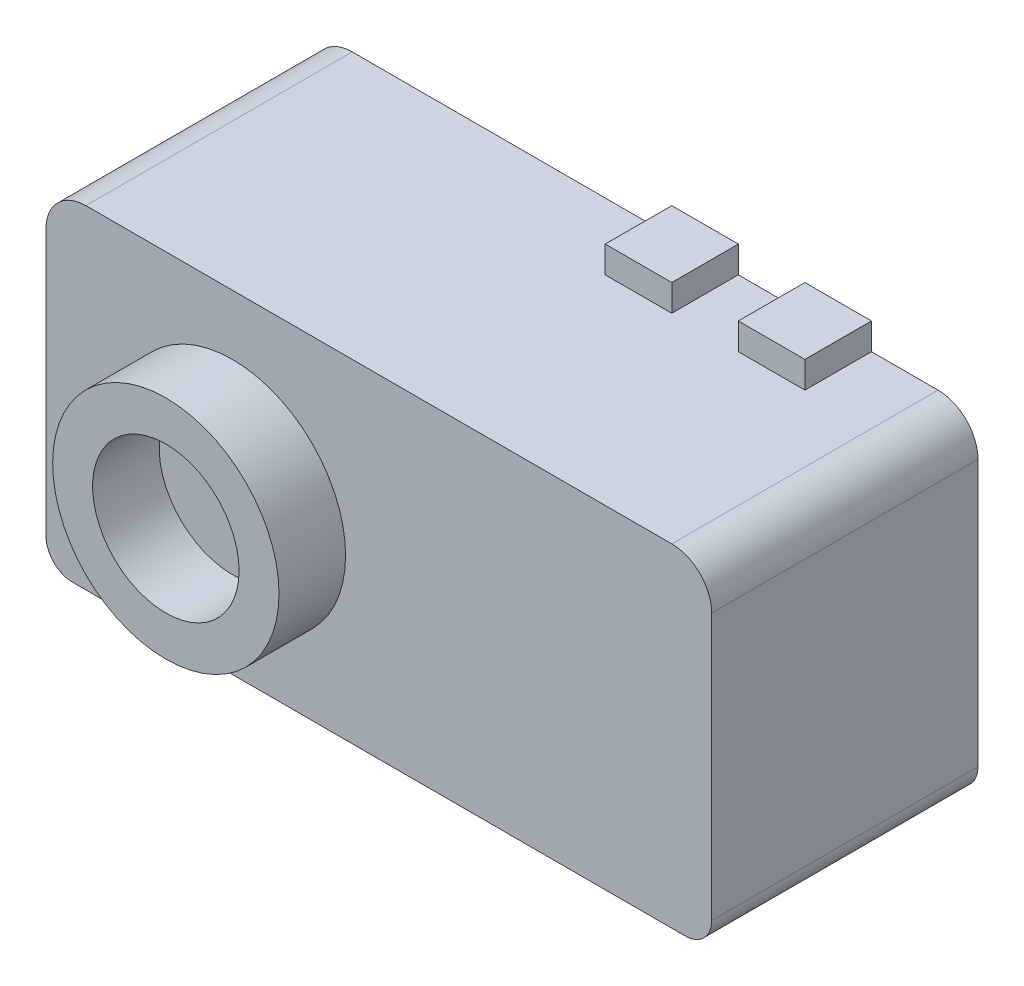
from build123d import *

# Parameters (mm, degrees)
BOSS_EXTRUDE1_DEPTH = 20
SKETCH2_W           = 5
SKETCH2_H           = 2
CUT_EXTRUDE1_DEPTH  = 15
SKETCH3_R           = 8.5
SKETCH3_R_2         = 5.5
BOSS_EXTRUDE2_DEPTH = 5
SKETCH4_W           = 11
SKETCH4_H           = 9
BOSS_EXTRUDE3_DEPTH = 10
SKETCH5_W           = 3
SKETCH5_H           = 3
CUT_EXTRUDE2_DEPTH  = 3
CUT_EXTRUDE3_START  = -8
SKETCH5_2_W         = 3
SKETCH5_2_H         = 3
CUT_EXTRUDE3_DEPTH  = 3


with BuildPart() as part:
    # Sketch1 → Boss-Extrude1 (new body)
    with BuildSketch(Plane.XY):
        with BuildLine():
            Line((-25, 10), (-25, -10))
            ThreePointArc((-25, -10), (-24.414213562, -11.414213562), (-23, -12))
            Line((-23, -12), (23, -12))
            ThreePointArc((23, -12), (24.414213562, -11.414213562), (25, -10))
            Line((25, -10), (25, 10))
            ThreePointArc((25, 10), (24.121320344, 12.121320344), (22, 13))
            Line((22, 13), (17, 13))
            Line((17, 13), (17, 15))
            Line((17, 15), (12, 15))
            Line((12, 15), (12, 13))
            Line((12, 13), (7, 13))
            Line((7, 13), (7, 15))
            Line((7, 15), (2, 15))
            Line((2, 15), (2, 13))
            Line((2, 13), (-22, 13))
            ThreePointArc((-22, 13), (-24.121320344, 12.121320344), (-25, 10))
        make_face()
    extrude(amount=BOSS_EXTRUDE1_DEPTH)

    # Sketch2 → Cut-Extrude1 (cut)
    with BuildSketch(Plane.XY.offset(20)):
        with Locations((4.5, 14)):
            Rectangle(SKETCH2_W, SKETCH2_H)
        with Locations((14.5, 14)):
            Rectangle(SKETCH2_W, SKETCH2_H)
    extrude(amount=-CUT_EXTRUDE1_DEPTH, mode=Mode.SUBTRACT)

    # Sketch3 → Boss-Extrude2 (add)
    with BuildSketch(Plane.XY.offset(20)):
        with Locations((-11, 0)):
            Circle(SKETCH3_R)
        with Locations((-11, 0)):
            Circle(SKETCH3_R_2, mode=Mode.SUBTRACT)
    extrude(amount=BOSS_EXTRUDE2_DEPTH)

    # Sketch4 → Boss-Extrude3 (add)
    with BuildSketch(Plane.XZ.offset(12)):
        with Locations((0, 4.5)):
            Rectangle(SKETCH4_W, SKETCH4_H)
    extrude(amount=BOSS_EXTRUDE3_DEPTH)

    # Sketch5 → Cut-Extrude2 (cut)
    with BuildSketch(Plane(origin=(5.5, 0, 0), x_dir=(0, 0, -1), z_dir=(1, 0, 0))):
        with Locations((-7.5, -20.5)):
            Rectangle(SKETCH5_W, SKETCH5_H)
        with Locations((-1.5, -20.5)):
            Rectangle(SKETCH5_W, SKETCH5_H)
        with Locations((-7.5, -15.5)):
            Rectangle(SKETCH5_W, SKETCH5_H)
        with Locations((-1.5, -15.5)):
            Rectangle(SKETCH5_W, SKETCH5_H)
    extrude(amount=-CUT_EXTRUDE2_DEPTH, mode=Mode.SUBTRACT)

    # Sketch5<2> → Cut-Extrude3 (cut)
    with BuildSketch(Plane(origin=(5.5, 0, 0), x_dir=(0, 0, -1), z_dir=(1, 0, 0)).offset(CUT_EXTRUDE3_START)):
        with Locations((-7.5, -20.5)):
            Rectangle(SKETCH5_2_W, SKETCH5_2_H)
        with Locations((-1.5, -20.5)):
            Rectangle(SKETCH5_2_W, SKETCH5_2_H)
        with Locations((-7.5, -15.5)):
            Rectangle(SKETCH5_2_W, SKETCH5_2_H)
        with Locations((-1.5, -15.5)):
            Rectangle(SKETCH5_2_W, SKETCH5_2_H)
    extrude(amount=-CUT_EXTRUDE3_DEPTH, mode=Mode.SUBTRACT)


solid = part.part
